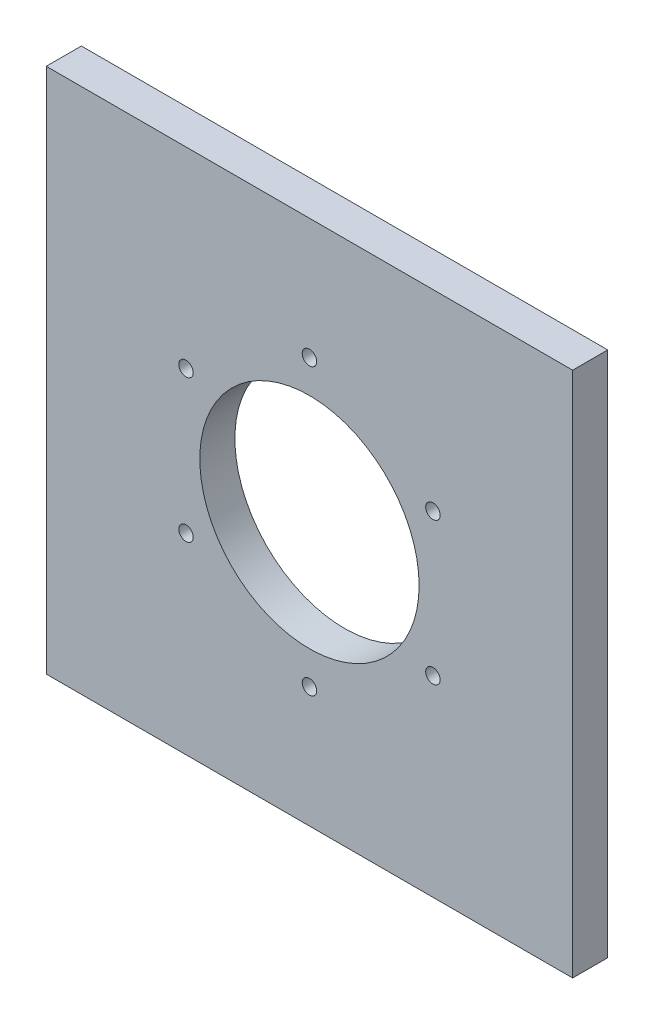
from build123d import *

# Parameters (mm, degrees)
SKETCH1_W           = 120
SKETCH1_H           = 120
SKETCH1_R           = 25
BOSS_EXTRUDE1_DEPTH = 8
SKETCH2_R           = 1.65
CUT_EXTRUDE2_DEPTH  = 86.229103011
CIRPATTERN1_COUNT   = 6


with BuildPart() as part:
    # Sketch1 → Boss-Extrude1 (new body)
    with BuildSketch(Plane.XY):
        Rectangle(SKETCH1_W, SKETCH1_H)
        Circle(SKETCH1_R, mode=Mode.SUBTRACT)
    extrude(amount=BOSS_EXTRUDE1_DEPTH)

    # Sketch2 → Cut-Extrude2 (cut, through all)
    with BuildSketch(Plane.XY):
        with Locations((0, 32.5)):
            Circle(SKETCH2_R)
    cut_extrude2 = extrude(amount=CUT_EXTRUDE2_DEPTH, mode=Mode.SUBTRACT)

    # CirPattern1: Cut-Extrude2 ×6 about axis
    cirpattern1_axis = Axis((0, 0, 0), (0, 0, 1))
    for i in range(1, CIRPATTERN1_COUNT):
        add(cut_extrude2.rotate(cirpattern1_axis, i * 360 / CIRPATTERN1_COUNT), mode=Mode.SUBTRACT)


solid = part.part
